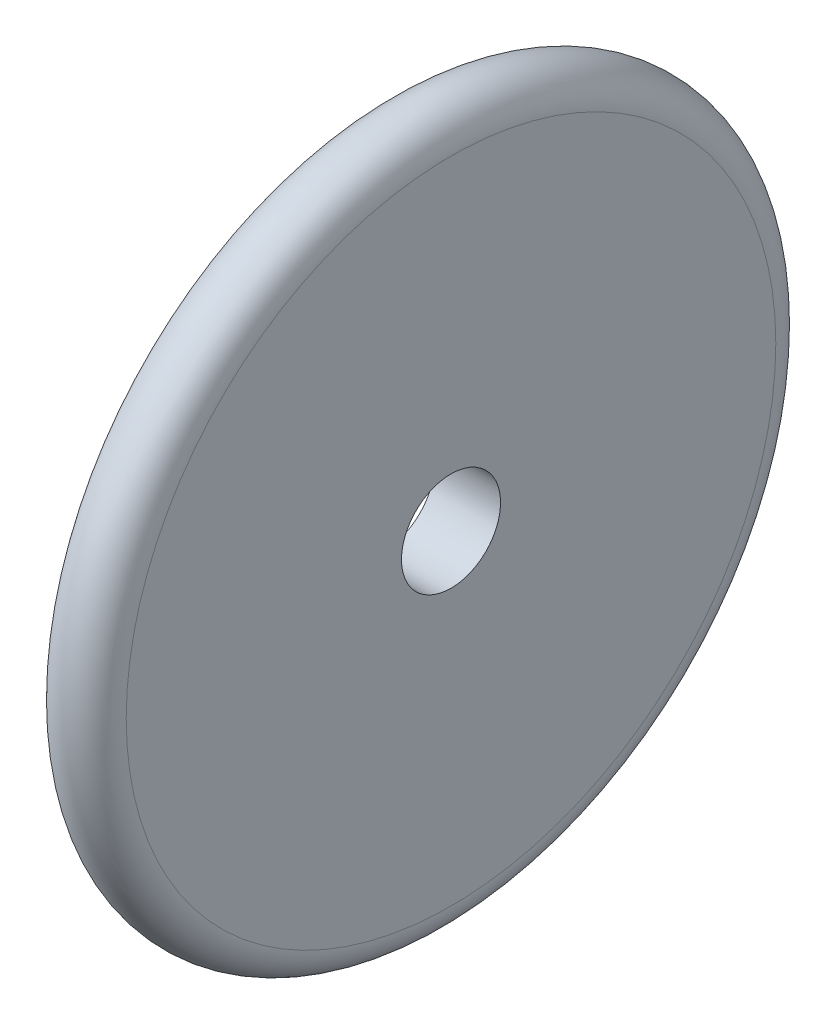
from build123d import *


with BuildPart() as part:
    # Sketch2 → Revolve1 (revolve)
    with BuildSketch(Plane(origin=(0, 0, 0), x_dir=(1, 0, 0), z_dir=(0, 1, 0)), mode=Mode.PRIVATE) as revolve1_sk:
        with BuildLine():
            Line((9.525, -44.45), (-9.525, -44.45))
            Line((-9.525, -44.45), (-9.525, 34.925))
            ThreePointArc((-9.525, 34.925), (0, 44.45), (9.525, 34.925))
            Line((9.525, 34.925), (9.525, -44.45))
        make_face()
    revolve(revolve1_sk.sketch.rotate(Axis((-9.525, 0, 58.7375), (1, 0, 0)), 180), axis=Axis((-9.525, 0, 58.7375), (1, 0, 0)))


solid = part.part
